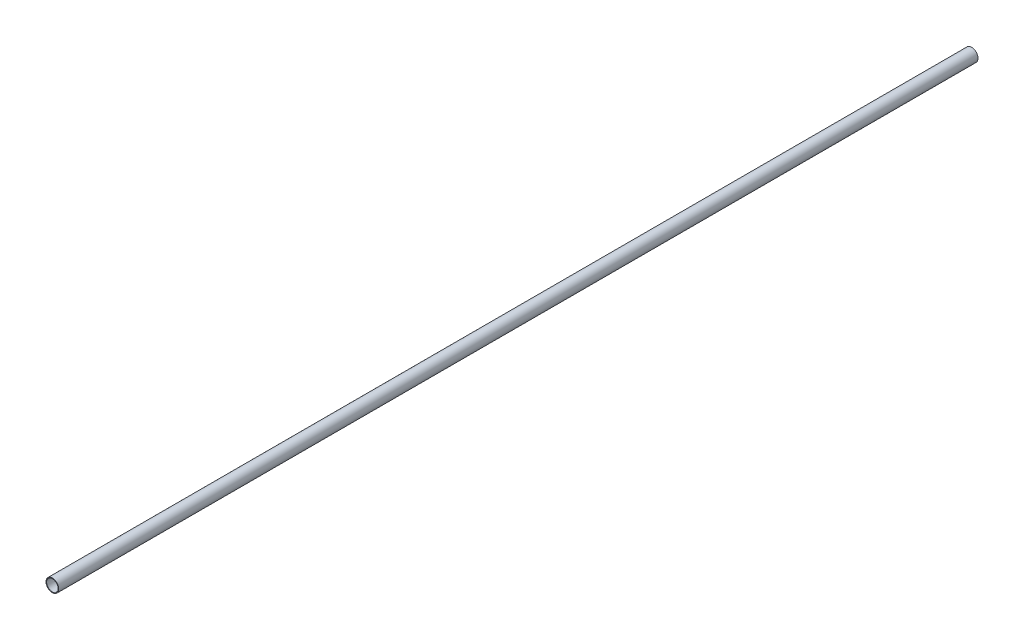
from build123d import *

# Parameters (mm, degrees)
SKETCH3_R           = 12.7
SKETCH3_R_2         = 11.4554
BOSS_EXTRUDE1_DEPTH = 914.4


with BuildPart() as part:
    # Sketch3 → Boss-Extrude1 (new, symmetric)
    with BuildSketch(Plane.XY):
        Circle(SKETCH3_R)
        Circle(SKETCH3_R_2, mode=Mode.SUBTRACT)
    extrude(amount=BOSS_EXTRUDE1_DEPTH, both=True)


solid = part.part
